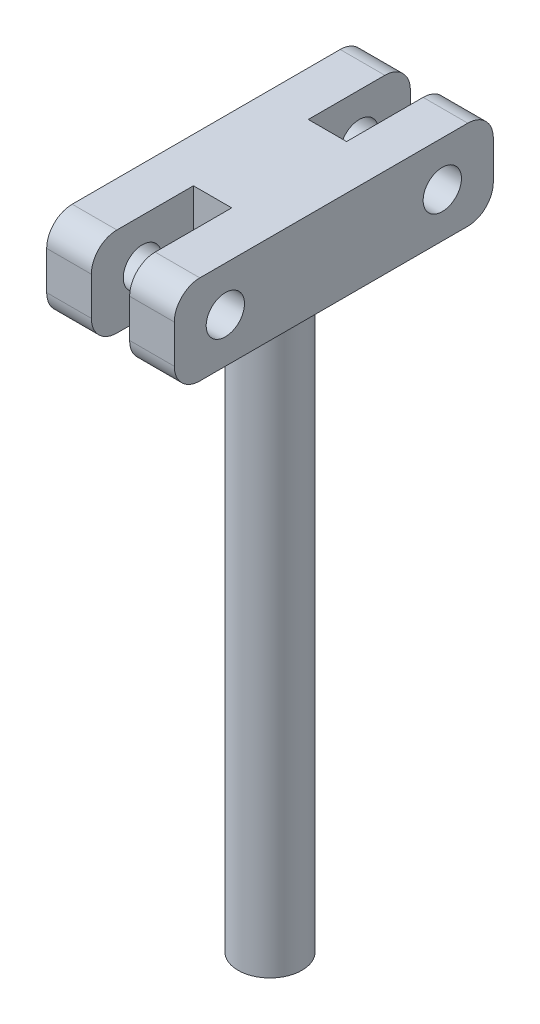
from build123d import *

# Parameters (mm, degrees)
CROQUIS1_R                 = 2.5
SALIENTE_EXTRUIR1_DEPTH    = 50
CROQUIS2_R                 = 1.5
SALIENTE_EXTRUIR2_DEPTH    = 5
CORTAR_EXTRUIR1_DEPTH      = 56.167925464
CORTAR_EXTRUIR1_DEPTH_BACK = 56.167925464
CROQUIS3_W                 = 3
CROQUIS3_H                 = 8


with BuildPart() as part:
    # Croquis1 → Saliente-Extruir1 (new body)
    with BuildSketch(Plane(origin=(0, 0, 0), x_dir=(1, 0, 0), z_dir=(0, 1, 0))):
        with Locations(Location((0, 0, 0), (0, 0, 270))):
            Circle(CROQUIS1_R)
    extrude(amount=-SALIENTE_EXTRUIR1_DEPTH)

    # Croquis2 → Saliente-Extruir2 (add, symmetric)
    with BuildSketch(Plane(origin=(0, 0, 0), x_dir=(0, 0, -1), z_dir=(1, 0, 0))):
        with BuildLine():
            Line((10.5, -3.5), (-10.5, -3.5))
            ThreePointArc((-10.5, -3.5), (-11.914213562, -2.914213562), (-12.5, -1.5))
            Line((-12.5, -1.5), (-12.5, 1.5))
            ThreePointArc((-12.5, 1.5), (-11.914213562, 2.914213562), (-10.5, 3.5))
            Line((-10.5, 3.5), (10.5, 3.5))
            ThreePointArc((10.5, 3.5), (11.914213562, 2.914213562), (12.5, 1.5))
            Line((12.5, 1.5), (12.5, -1.5))
            ThreePointArc((12.5, -1.5), (11.914213562, -2.914213562), (10.5, -3.5))
        make_face()
        with Locations((-8.5, 0)):
            Circle(CROQUIS2_R, mode=Mode.SUBTRACT)
        with Locations((8.5, 0)):
            Circle(CROQUIS2_R, mode=Mode.SUBTRACT)
    extrude(amount=SALIENTE_EXTRUIR2_DEPTH, both=True)

    # Croquis3 → Cortar-Extruir1 (cut, two sides: drawn at the far end of the back side and taken through both)
    with BuildSketch(Plane(origin=(0, 3.5, 0), x_dir=(1, 0, 0), z_dir=(0, 1, 0)).offset(-CORTAR_EXTRUIR1_DEPTH_BACK)):
        with Locations((0, 8.5)):
            Rectangle(CROQUIS3_W, CROQUIS3_H)
        with Locations((0, -8.5)):
            Rectangle(CROQUIS3_W, CROQUIS3_H)
    extrude(amount=CORTAR_EXTRUIR1_DEPTH + CORTAR_EXTRUIR1_DEPTH_BACK, mode=Mode.SUBTRACT)


solid = part.part
